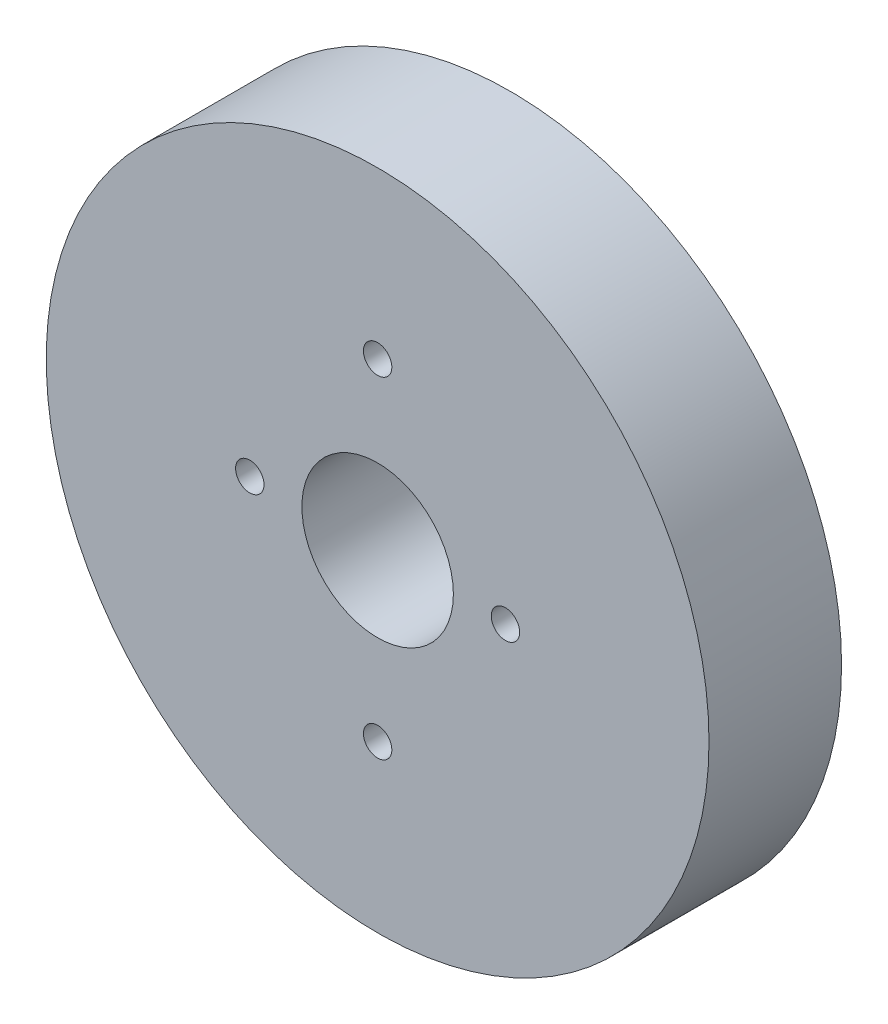
from build123d import *

# Parameters (mm, degrees)
SKETCH_1_R      = 17.5
SKETCH_1_R_2    = 4
SKETCH_1_R_3    = 0.75
EXTRUDE_1_DEPTH = 7


with BuildPart() as part:
    # 草图1 → 凸台-拉伸1 (new body)
    with BuildSketch(Plane.XY):
        Circle(SKETCH_1_R)
        Circle(SKETCH_1_R_2, mode=Mode.SUBTRACT)
        with Locations((6.75, 0)):
            Circle(SKETCH_1_R_3, mode=Mode.SUBTRACT)
        with Locations((0, 8.75)):
            Circle(SKETCH_1_R_3, mode=Mode.SUBTRACT)
        with Locations(Location((-6.75, 0, 0), (0, 0, 180))):
            Circle(SKETCH_1_R_3, mode=Mode.SUBTRACT)
        with Locations(Location((0, -8.75, 0), (0, 0, 180))):
            Circle(SKETCH_1_R_3, mode=Mode.SUBTRACT)
    extrude(amount=EXTRUDE_1_DEPTH)


solid = part.part
